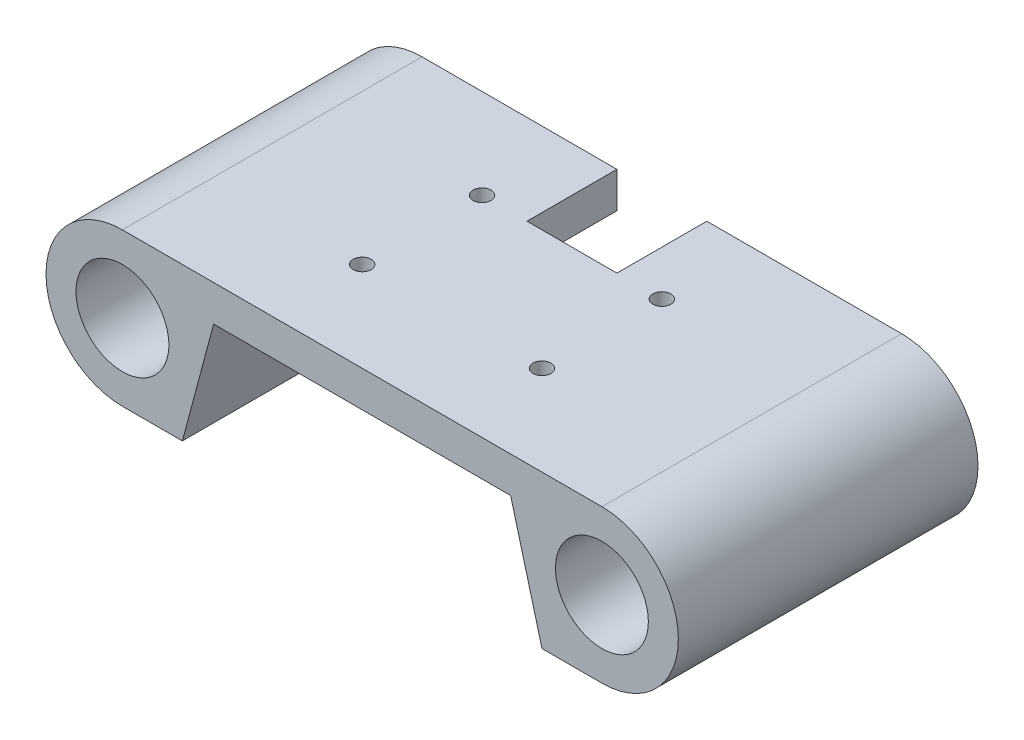
from build123d import *

# Parameters (mm, degrees)
ESBO_O1_R                = 7.75
RESSALTO_EXTRUS_O1_DEPTH = 50
ESBO_O2_R                = 1.5
ESBO_O2_W                = 15
ESBO_O2_H                = 15
CORTE_EXTRUS_O1_DEPTH    = 30


with BuildPart() as part:
    # Esboço1 → Ressalto-extrusão1 (new body)
    with BuildSketch(Plane.XY):
        with BuildLine():
            Line((40, 0), (-40, 0))
            ThreePointArc((-40, 0), (-52.749521473, -12.749521473), (-40, -25.499042945))
            Line((-40, -25.499042945), (-30, -25.499042945))
            Line((-30, -25.499042945), (-24.77524719, -6))
            Line((-24.77524719, -6), (24.77524719, -6))
            Line((24.77524719, -6), (30, -25.499042945))
            Line((30, -25.499042945), (40, -25.499042945))
            ThreePointArc((40, -25.499042945), (52.749521473, -12.749521473), (40, 0))
        make_face()
        with Locations(Location((-40, -12.749521473, 0), (0, 0, 180))):
            Circle(ESBO_O1_R, mode=Mode.SUBTRACT)
        with Locations((40, -12.749521473)):
            Circle(ESBO_O1_R, mode=Mode.SUBTRACT)
    extrude(amount=RESSALTO_EXTRUS_O1_DEPTH)

    # Esboço2 → Corte-extrusão1 (cut)
    with BuildSketch(Plane.XZ.offset(25.499042945)):
        with Locations((15, 35)):
            Circle(ESBO_O2_R)
        with Locations((15, 15)):
            Circle(ESBO_O2_R)
        with Locations((-15, 15)):
            Circle(ESBO_O2_R)
        with Locations((-15, 35)):
            Circle(ESBO_O2_R)
        with Locations((0, 7.5)):
            Rectangle(ESBO_O2_W, ESBO_O2_H)
    extrude(amount=-CORTE_EXTRUS_O1_DEPTH, mode=Mode.SUBTRACT)


solid = part.part
